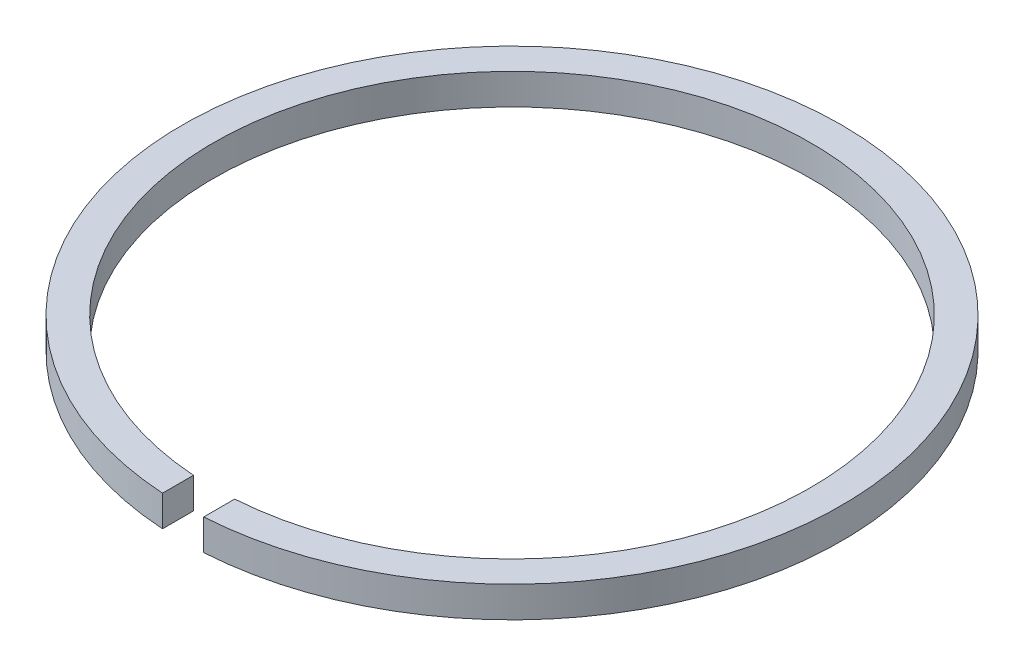
from build123d import *

# Parameters (mm, degrees)
BOSS_EXTRUDE1_DEPTH = 0.75


with BuildPart() as part:
    # Sketch1 → Boss-Extrude1 (new, symmetric)
    with BuildSketch(Plane(origin=(0, 0, 0), x_dir=(1, 0, 0), z_dir=(0, 1, 0))):
        with BuildLine():
            Line((-1, -14.465476141), (-1, -15.968719423))
            ThreePointArc((-1, -15.968719423), (0, 16), (1, -15.968719423))
            Line((1, -15.968719423), (1, -14.465476141))
            ThreePointArc((1, -14.465476141), (0, 14.5), (-1, -14.465476141))
        make_face()
    extrude(amount=BOSS_EXTRUDE1_DEPTH, both=True)


solid = part.part
